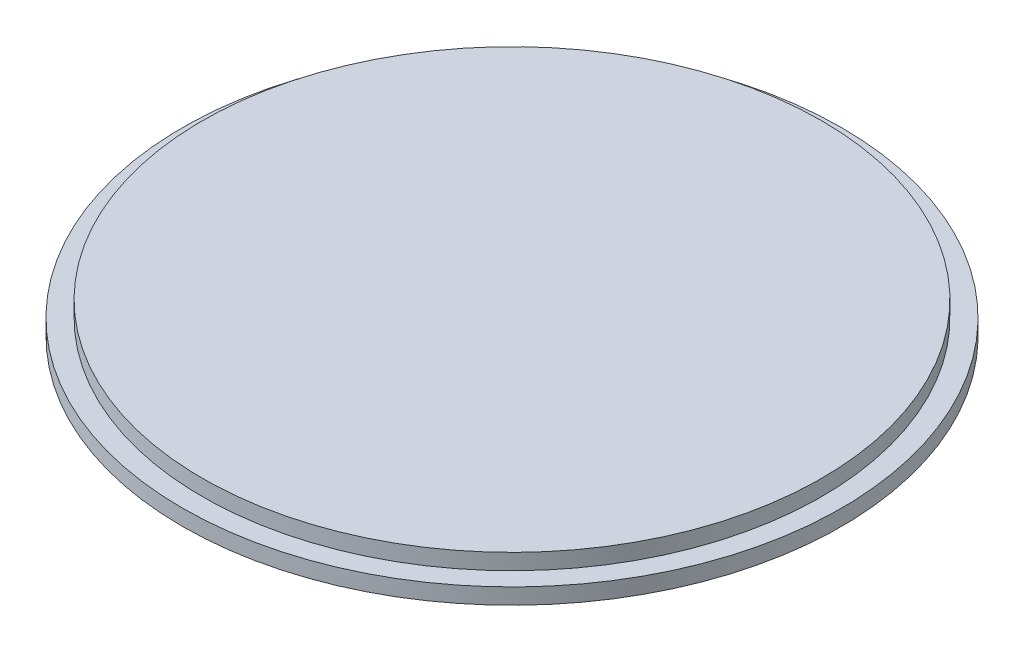
from build123d import *

# Parameters (mm, degrees)
SKETCH1_R           = 49.403
BOSS_EXTRUDE1_DEPTH = 2.38125
SKETCH2_R           = 46.42485
BOSS_EXTRUDE2_DEPTH = 2.38125


with BuildPart() as part:
    # Sketch1 → Boss-Extrude1 (new body)
    with BuildSketch(Plane(origin=(0, 0, 0), x_dir=(1, 0, 0), z_dir=(0, 1, 0))):
        with Locations(Location((0, 0, 0), (0, 0, 90))):
            Circle(SKETCH1_R)
    extrude(amount=BOSS_EXTRUDE1_DEPTH)

    # Sketch2 → Boss-Extrude2 (add)
    with BuildSketch(Plane(origin=(0, 2.38125, 0), x_dir=(1, 0, 0), z_dir=(0, 1, 0))):
        with Locations(Location((0, 0, 0), (0, 0, 90))):
            Circle(SKETCH2_R)
    extrude(amount=BOSS_EXTRUDE2_DEPTH)


solid = part.part
